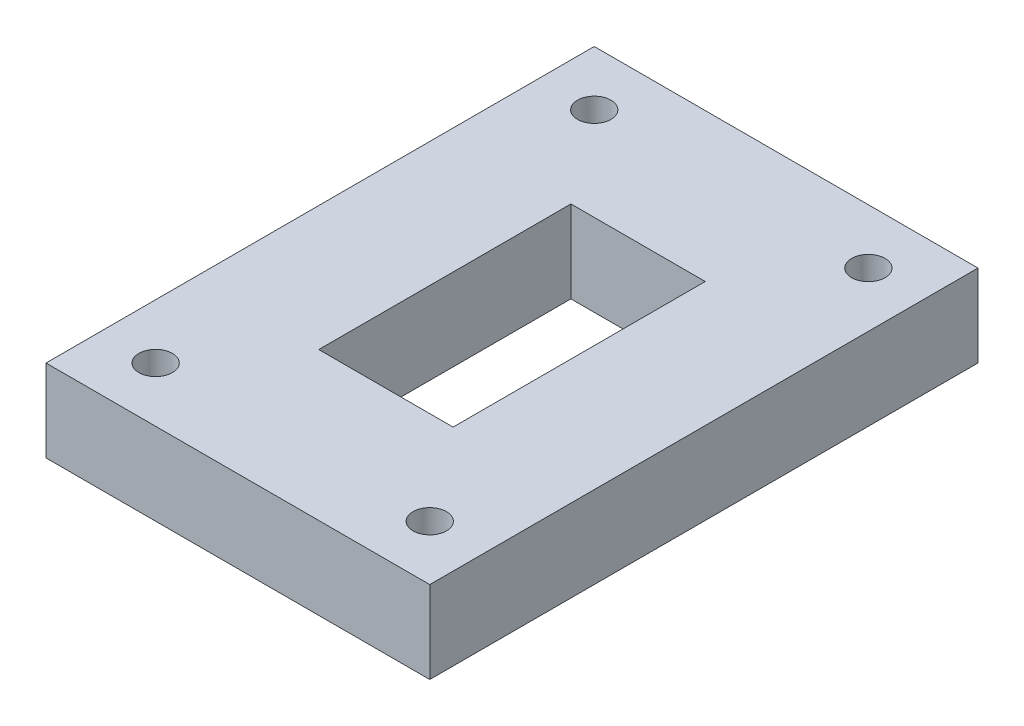
from build123d import *

# Parameters (mm, degrees)
SKETCH_1_W          = 35
SKETCH_1_H          = 50
SKETCH_1_W_2        = 12.25
SKETCH_1_H_2        = 23
EXTRUDE_2_DEPTH     = 7.5
SKETCH_2_R          = 1.525
CUT_EXTRUDE_1_DEPTH = 62.491869381


with BuildPart() as part:
    # 草图1 → 凸台-拉伸2 (new body)
    with BuildSketch(Plane(origin=(0, 0, 0), x_dir=(1, 0, 0), z_dir=(0, 1, 0))):
        with Locations((17.5, -25)):
            Rectangle(SKETCH_1_W, SKETCH_1_H)
        with Locations((17.5, -25)):
            Rectangle(SKETCH_1_W_2, SKETCH_1_H_2, mode=Mode.SUBTRACT)
    extrude(amount=-EXTRUDE_2_DEPTH)

    # 草图2 → 切除-拉伸1 (cut, through all)
    with BuildSketch(Plane.XZ.offset(7.5)):
        with Locations(Location((5, 5, 0), (0, 0, 270))):
            Circle(SKETCH_2_R)
        with Locations(Location((5, 45, 0), (0, 0, 90))):
            Circle(SKETCH_2_R)
        with Locations(Location((30, 45, 0), (0, 0, 270))):
            Circle(SKETCH_2_R)
        with Locations(Location((30, 5, 0), (0, 0, 90))):
            Circle(SKETCH_2_R)
    extrude(amount=-CUT_EXTRUDE_1_DEPTH, mode=Mode.SUBTRACT)


solid = part.part
